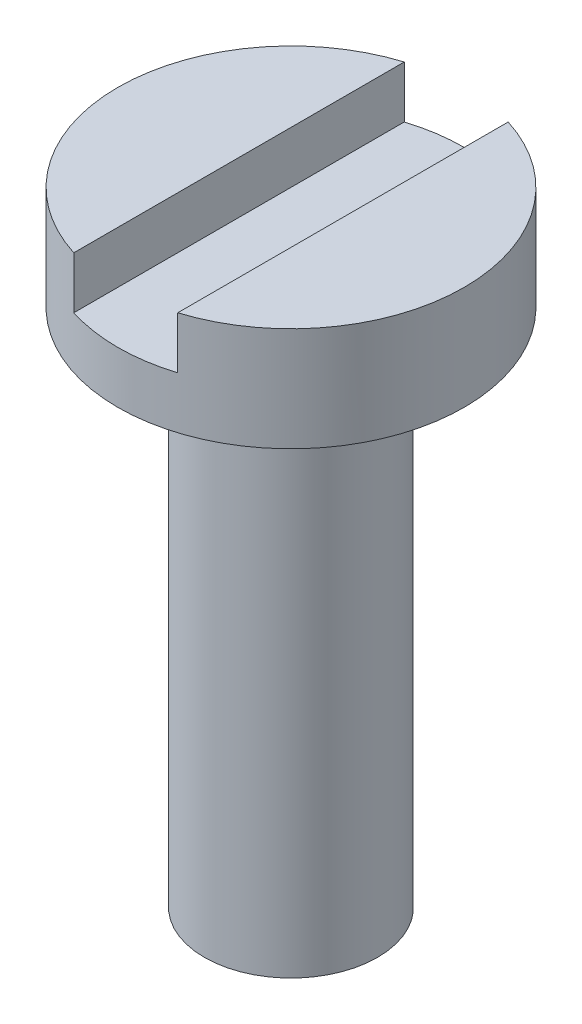
from build123d import *

# Parameters (mm, degrees)
SKETCH1_R           = 2.5
BOSS_EXTRUDE1_DEPTH = 15
SKETCH2_R           = 5
BOSS_EXTRUDE2_DEPTH = 3
CUT_EXTRUDE1_START  = -1.5
CUT_EXTRUDE1_DEPTH  = 1.5


with BuildPart() as part:
    # Sketch1 → Boss-Extrude1 (new body)
    with BuildSketch(Plane(origin=(0, 0, 0), x_dir=(1, 0, 0), z_dir=(0, 1, 0))):
        with Locations(Location((0, 0, 0), (0, 0, 270))):
            Circle(SKETCH1_R)
    extrude(amount=BOSS_EXTRUDE1_DEPTH)

    # Sketch2 → Boss-Extrude2 (add)
    with BuildSketch(Plane(origin=(0, 15, 0), x_dir=(1, 0, 0), z_dir=(0, 1, 0))):
        with Locations(Location((0, 0, 0), (0, 0, 270))):
            Circle(SKETCH2_R)
    extrude(amount=BOSS_EXTRUDE2_DEPTH)

    # Sketch3 → Cut-Extrude1 (cut)
    with BuildSketch(Plane(origin=(0, 18, 0), x_dir=(1, 0, 0), z_dir=(0, 1, 0)).offset(CUT_EXTRUDE1_START)):
        with BuildLine():
            Line((-1.5, 4.769696007), (-1.5, -4.769696007))
            ThreePointArc((-1.5, -4.769696007), (0, -5), (1.5, -4.769696007))
            Line((1.5, -4.769696007), (1.5, 4.769696007))
            ThreePointArc((1.5, 4.769696007), (0, 5), (-1.5, 4.769696007))
        make_face()
    extrude(amount=CUT_EXTRUDE1_DEPTH, mode=Mode.SUBTRACT)


solid = part.part
